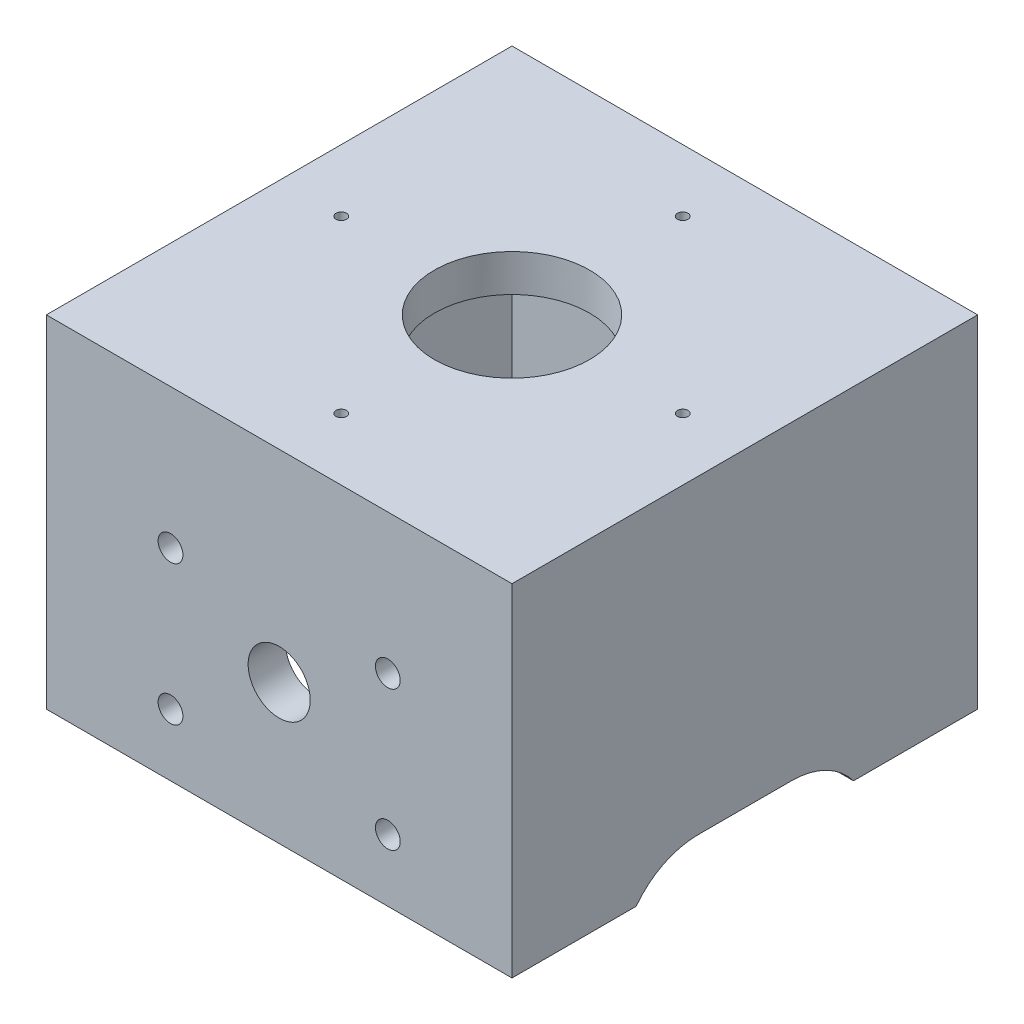
from build123d import *

# Parameters (mm, degrees)
SKETCH1_W           = 150
SKETCH1_H           = 150
BOSS_EXTRUDE1_DEPTH = 110
SKETCH3_W           = 126
SKETCH3_H           = 126
CUT_EXTRUDE1_DEPTH  = 98
SKETCH4_R           = 1.7
SKETCH4_R_2         = 25
CUT_EXTRUDE2_DEPTH  = 239.956062907
CUT_EXTRUDE3_DEPTH  = 239.956062907
CUT_EXTRUDE4_START  = 150
CUT_EXTRUDE4_DEPTH  = 12
SKETCH5_R           = 4
SKETCH5_R_2         = 10
CUT_EXTRUDE5_DEPTH  = 12


with BuildPart() as part:
    # Sketch1 → Boss-Extrude1 (new body)
    with BuildSketch(Plane(origin=(0, 0, 0), x_dir=(1, 0, 0), z_dir=(0, 1, 0))):
        with Locations((75, 75)):
            Rectangle(SKETCH1_W, SKETCH1_H)
    extrude(amount=BOSS_EXTRUDE1_DEPTH)

    # Sketch3 → Cut-Extrude1 (cut)
    with BuildSketch(Plane.XZ):
        with Locations((75, -75)):
            Rectangle(SKETCH3_W, SKETCH3_H)
    extrude(amount=-CUT_EXTRUDE1_DEPTH, mode=Mode.SUBTRACT)

    # Sketch4 → Cut-Extrude2 (cut, through all)
    with BuildSketch(Plane(origin=(0, 110, 0), x_dir=(1, 0, 0), z_dir=(0, 1, 0))):
        with Locations(Location((75, 130, 0), (0, 0, 270))):
            Circle(SKETCH4_R)
        with Locations(Location((130, 75, 0), (0, 0, 270))):
            Circle(SKETCH4_R)
        with Locations(Location((75, 20, 0), (0, 0, 270))):
            Circle(SKETCH4_R)
        with Locations(Location((20, 75, 0), (0, 0, 270))):
            Circle(SKETCH4_R)
        with Locations(Location((75, 75, 0), (0, 0, 270))):
            Circle(SKETCH4_R_2)
    extrude(amount=-CUT_EXTRUDE2_DEPTH, mode=Mode.SUBTRACT)

    # Sketch6 → Cut-Extrude3 (cut, through all)
    with BuildSketch(Plane.ZY):
        with BuildLine():
            Line((-90, 10), (-60, 10))
            ThreePointArc((-60, 10), (-48.819660113, 7.360679775), (-40, 0))
            Line((-40, 0), (-110, 0))
            ThreePointArc((-110, 0), (-101.180339887, 7.360679775), (-90, 10))
        make_face()
    extrude(amount=-CUT_EXTRUDE3_DEPTH, mode=Mode.SUBTRACT)

    # Sketch7 → Cut-Extrude4 (cut)
    with BuildSketch(Plane(origin=(0, 0, 0), x_dir=(-1, 0, 0), z_dir=(0, 0, -1)).offset(CUT_EXTRUDE4_START)):
        with BuildLine():
            Line((-90, 10), (-60, 10))
            ThreePointArc((-60, 10), (-48.819660113, 7.360679775), (-40, 0))
            Line((-40, 0), (-110, 0))
            ThreePointArc((-110, 0), (-101.180339887, 7.360679775), (-90, 10))
        make_face()
    extrude(amount=-CUT_EXTRUDE4_DEPTH, mode=Mode.SUBTRACT)

    # Sketch5 → Cut-Extrude5 (cut)
    with BuildSketch(Plane.XY):
        with Locations((40, 65)):
            Circle(SKETCH5_R)
        with Locations((75, 45)):
            Circle(SKETCH5_R_2)
        with Locations((110, 65)):
            Circle(SKETCH5_R)
        with Locations((40, 20)):
            Circle(SKETCH5_R)
        with Locations((110, 20)):
            Circle(SKETCH5_R)
    extrude(amount=-CUT_EXTRUDE5_DEPTH, mode=Mode.SUBTRACT)


solid = part.part
